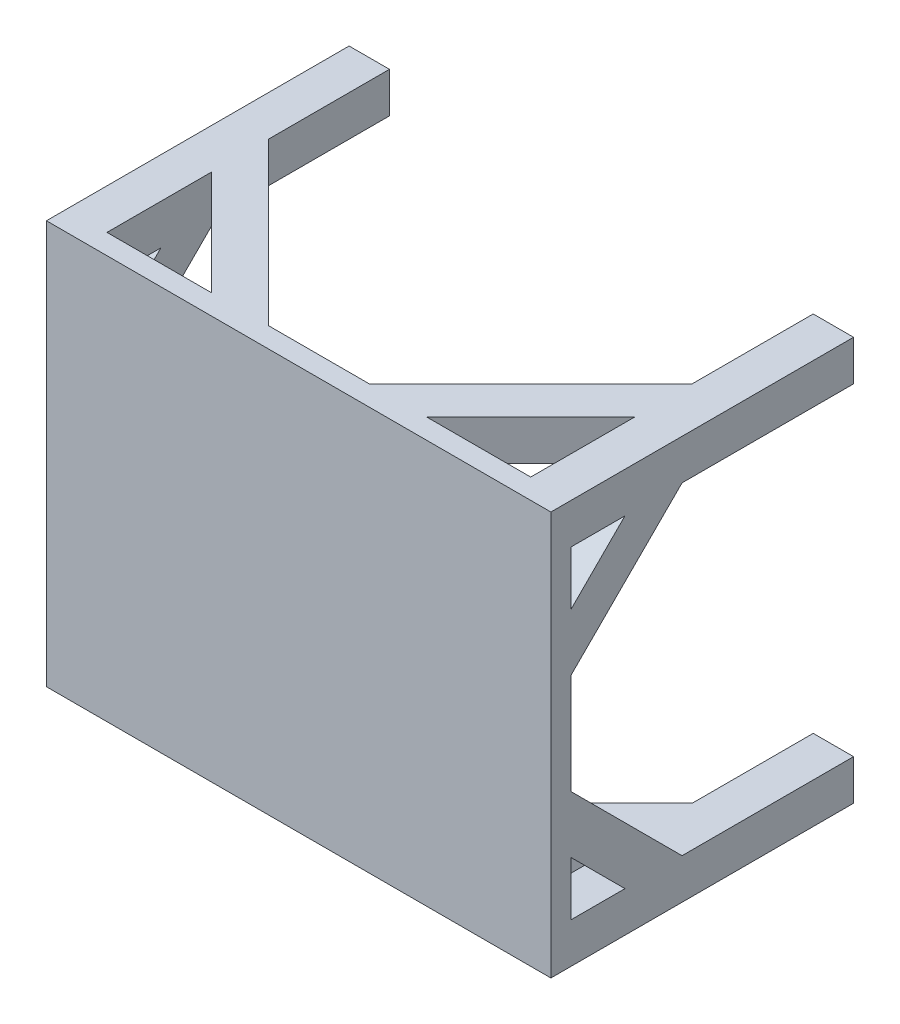
from build123d import *

# Parameters (mm, degrees)
SKETCH_1_W      = 500
SKETCH_1_H      = 400
EXTRUDE_1_DEPTH = 20
SKETCH_2_W      = 40
SKETCH_2_H      = 40
EXTRUDE_2_DEPTH = 280
EXTRUDE_3_DEPTH = 40
EXTRUDE_START   = -360
EXTRUDE_4_DEPTH = 40
EXTRUDE_5_DEPTH = 40
EXTRUDE_START_2 = -460
EXTRUDE_6_DEPTH = 40


with BuildPart() as part:
    # 草图1 → 凸台-拉伸1 (new body)
    with BuildSketch(Plane.XY):
        Rectangle(SKETCH_1_W, SKETCH_1_H)
    extrude(amount=EXTRUDE_1_DEPTH)

    # 草图2 → 凸台-拉伸2 (add)
    with BuildSketch(Plane(origin=(0, 0, 0), x_dir=(-1, 0, 0), z_dir=(0, 0, -1))):
        with Locations((-230, 180)):
            Rectangle(SKETCH_2_W, SKETCH_2_H)
        with Locations((230, 180)):
            Rectangle(SKETCH_2_W, SKETCH_2_H)
        with Locations((230, -180)):
            Rectangle(SKETCH_2_W, SKETCH_2_H)
        with Locations((-230, -180)):
            Rectangle(SKETCH_2_W, SKETCH_2_H)
    extrude(amount=EXTRUDE_2_DEPTH)

    # 草图3 → 凸台-拉伸3 (add)
    with BuildSketch(Plane(origin=(0, 200, 0), x_dir=(1, 0, 0), z_dir=(0, 1, 0))):
        Polygon((-210, 160), (-50, 0), (-106.568542495, 0), (-210, 103.431457505), align=None)
        Polygon((106.568542495, 0), (210, 103.431457505), (210, 160), (50, 0), align=None)
    extrude(amount=-EXTRUDE_3_DEPTH)

    # 草图3<3> → 凸台-拉伸4 (add)
    with BuildSketch(Plane(origin=(0, 200, 0), x_dir=(1, 0, 0), z_dir=(0, 1, 0)).offset(EXTRUDE_START)):
        Polygon((-210, 160), (-50, 0), (-106.568542495, 0), (-210, 103.431457505), align=None)
        Polygon((106.568542495, 0), (210, 103.431457505), (210, 160), (50, 0), align=None)
    extrude(amount=-EXTRUDE_4_DEPTH)

    # 草图4 → 凸台-拉伸5 (add)
    with BuildSketch(Plane(origin=(250, 0, 0), x_dir=(0, 0, -1), z_dir=(1, 0, 0))):
        Polygon((0, 50), (110, 160), (53.431457505, 160), (0, 106.568542495), align=None)
        Polygon((53.431457505, -160), (0, -106.568542495), (0, -50), (110, -160), align=None)
    extrude(amount=-EXTRUDE_5_DEPTH)

    # 草图4<2> → 凸台-拉伸6 (add)
    with BuildSketch(Plane(origin=(250, 0, 0), x_dir=(0, 0, -1), z_dir=(1, 0, 0)).offset(EXTRUDE_START_2)):
        Polygon((0, 50), (110, 160), (53.431457505, 160), (0, 106.568542495), align=None)
        Polygon((53.431457505, -160), (0, -106.568542495), (0, -50), (110, -160), align=None)
    extrude(amount=-EXTRUDE_6_DEPTH)


solid = part.part
